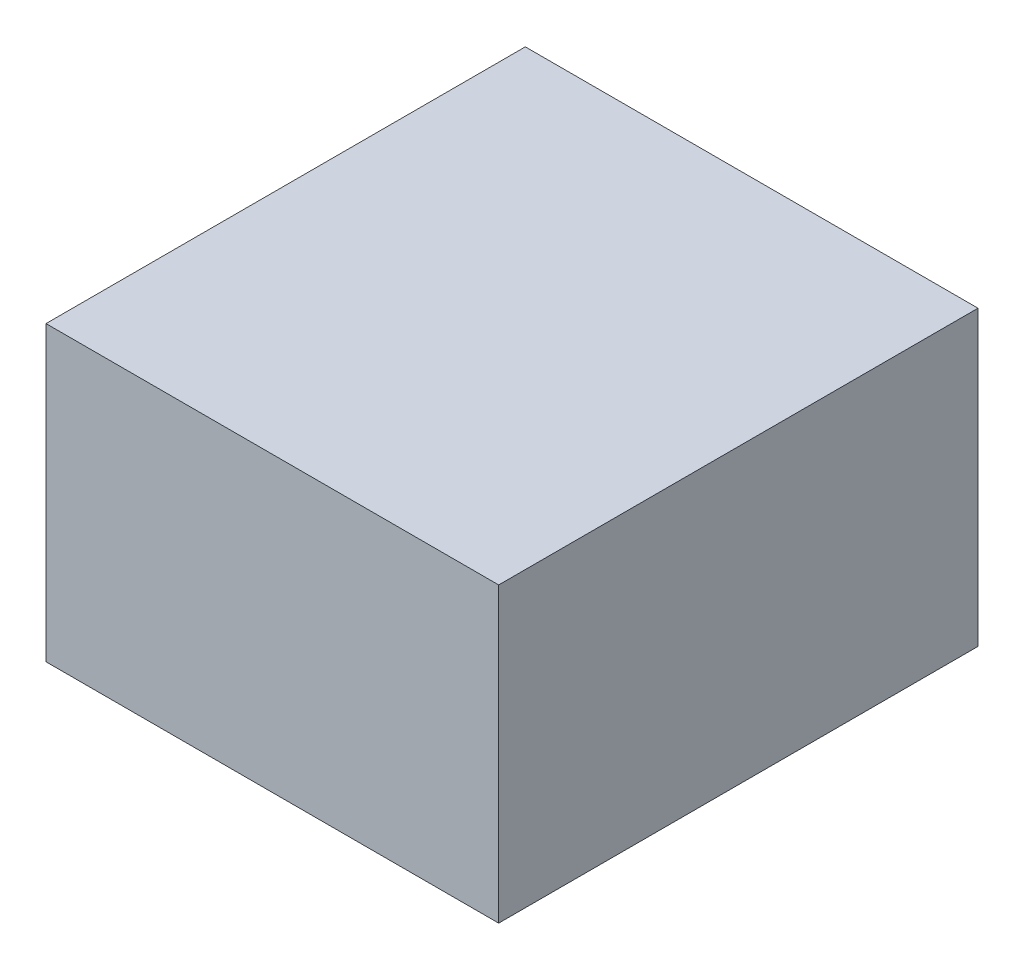
from build123d import *

# Parameters (mm, degrees)
CROQUIS1_W              = 340
CROQUIS1_H              = 360
SALIENTE_EXTRUIR1_DEPTH = 220


with BuildPart() as part:
    # Croquis1 → Saliente-Extruir1 (new body)
    with BuildSketch(Plane(origin=(0, 0, 0), x_dir=(1, 0, 0), z_dir=(0, 1, 0))):
        Rectangle(CROQUIS1_W, CROQUIS1_H)
    extrude(amount=SALIENTE_EXTRUIR1_DEPTH)


solid = part.part
